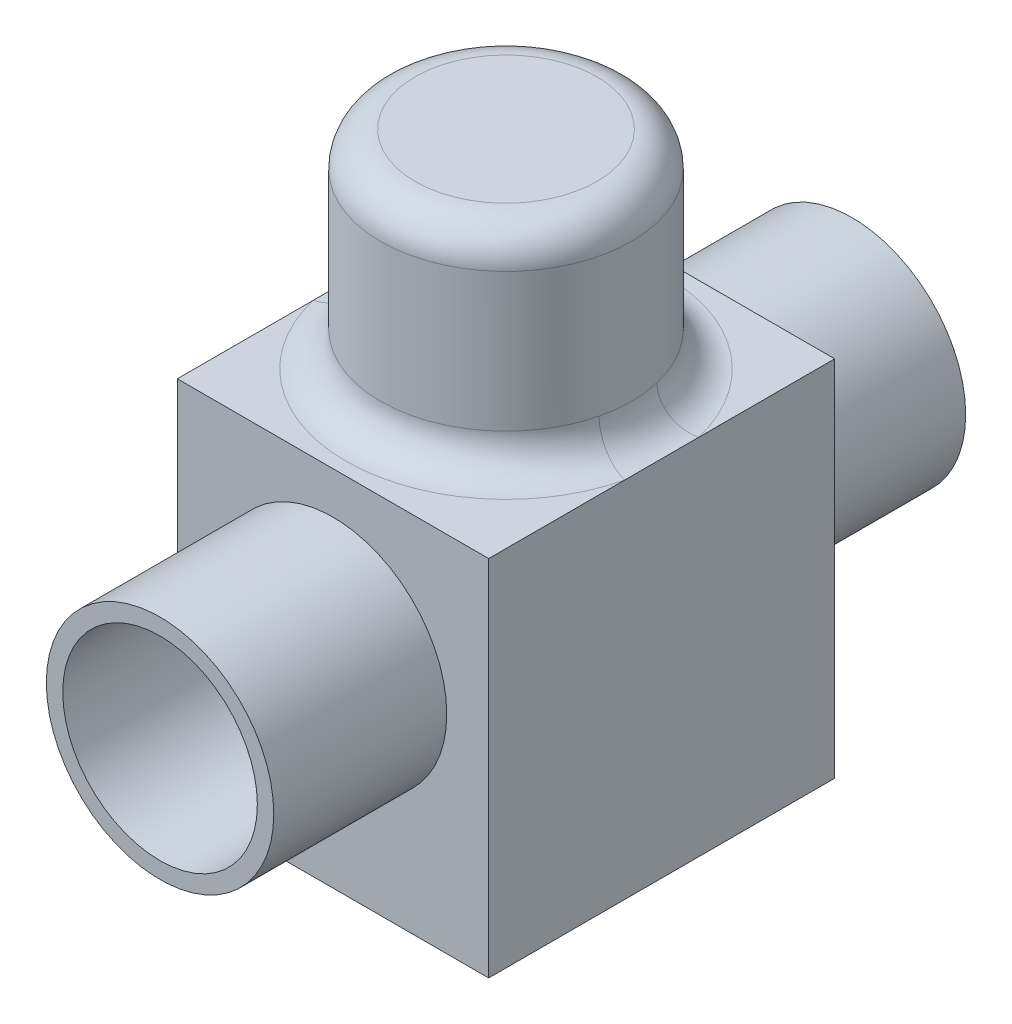
from build123d import *
from build123d.topology import SkipClean

# Parameters (mm, degrees)
SKETCH1_W           = 18
SKETCH1_H           = 20
BOSS_EXTRUDE1_DEPTH = 18
SKETCH6_R           = 7.25
BOSS_EXTRUDE4_DEPTH = 12
FILLET1_R           = 2
SKETCH2_R           = 6.575
SKETCH2_R_2         = 5.625
BOSS_EXTRUDE5_DEPTH = 10
BOSS_EXTRUDE6_START = 10
SKETCH3_R           = 6.575
SKETCH3_R_2         = 5.625
BOSS_EXTRUDE6_DEPTH = 10
SKETCH7_R           = 5.625
CUT_EXTRUDE2_DEPTH  = 41
SKETCH8_W           = 18
SKETCH8_H           = 20
BOSS_EXTRUDE7_DEPTH = 3


with BuildPart() as part:
    # Sketch1 → Boss-Extrude1 (new body)
    with BuildSketch(Plane(origin=(0, 0, 0), x_dir=(1, 0, 0), z_dir=(0, 1, 0))):
        Rectangle(SKETCH1_W, SKETCH1_H)
    extrude(amount=BOSS_EXTRUDE1_DEPTH)

    # Sketch6 → Boss-Extrude4 (add)
    with BuildSketch(Plane(origin=(0, 18, 0), x_dir=(1, 0, 0), z_dir=(0, 1, 0))):
        with Locations(Location((0, 0, 0), (0, 0, 270))):
            Circle(SKETCH6_R)
    extrude(amount=BOSS_EXTRUDE4_DEPTH)

    # Fillet1
    fillet1_edges = [part.edges().sort_by_distance(p)[0] for p in [
        (0, 18, -7.25),
        (0, 30, -7.25),
    ]]
    fillet(fillet1_edges, radius=FILLET1_R)

    # Sketch2 → Boss-Extrude5 (add)
    with BuildSketch(Plane.XY.offset(10)):
        with Locations(Location((0, 9, 0), (0, 0, 180))):
            Circle(SKETCH2_R)
        with Locations((0, 9)):
            Circle(SKETCH2_R_2, mode=Mode.SUBTRACT)
    extrude(amount=BOSS_EXTRUDE5_DEPTH)

    # Sketch3 → Boss-Extrude6 (add)
    with BuildSketch(Plane(origin=(0, 0, -10), x_dir=(-1, 0, 0), z_dir=(0, 0, -1)).offset(BOSS_EXTRUDE6_START)):
        with Locations((0, 9)):
            Circle(SKETCH3_R)
        with Locations(Location((0, 9, 0), (0, 0, 180))):
            Circle(SKETCH3_R_2, mode=Mode.SUBTRACT)
    extrude(amount=-BOSS_EXTRUDE6_DEPTH)

    # Sketch7 → Cut-Extrude2 (cut)
    with SkipClean():  # the faces are left unmerged after this step: merging them gives an invalid solid
        with BuildSketch(Plane(origin=(0, 0, -10), x_dir=(-1, 0, 0), z_dir=(0, 0, -1))):
            with Locations((0, 9)):
                Circle(SKETCH7_R)
        extrude(amount=-CUT_EXTRUDE2_DEPTH, mode=Mode.SUBTRACT)

    # Sketch8 → Boss-Extrude7 (add)
    with SkipClean():  # the faces are left unmerged after this step: merging them gives an invalid solid
        with BuildSketch(Plane.XZ):
            Rectangle(SKETCH8_W, SKETCH8_H)
        extrude(amount=BOSS_EXTRUDE7_DEPTH)


solid = part.part
